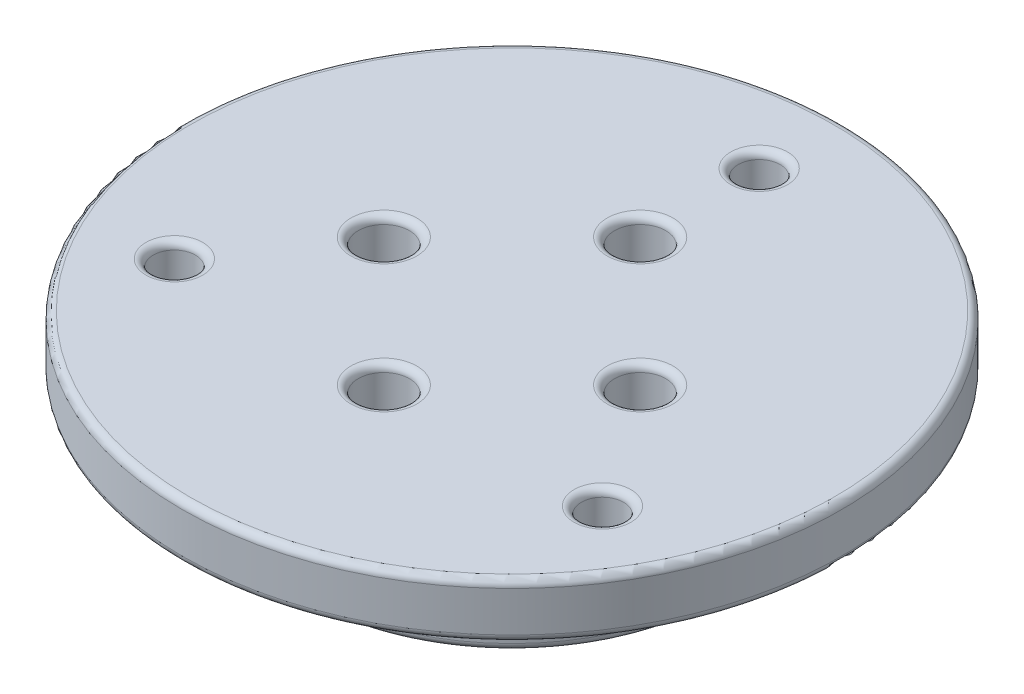
from build123d import *

# Parameters (mm, degrees)
SKETCH2_R          = 1.15
SKETCH2_R_2        = 1.4
CUT_EXTRUDE1_DEPTH = 27.683328128
FILLET2_R          = 0.4


with BuildPart() as part:
    # Sketch1 → Revolve1 (revolve)
    with BuildSketch(Plane.XY, mode=Mode.PRIVATE) as revolve1_sk:
        Polygon((0, 0), (11.5, 0), (11.5, 5), (18, 5), (18, 8), (0, 8), align=None)
    revolve(revolve1_sk.sketch.rotate(Axis((0, 0, 0), (0, 1, 0)), 90), axis=Axis((0, 0, 0), (0, 1, 0)))

    # Sketch2 → Cut-Extrude1 (cut, through all)
    with BuildSketch(Plane(origin=(0, 8, 0), x_dir=(1, 0, 0), z_dir=(0, 1, 0))):
        with Locations(Location((0, 13.5, 0), (0, 0, 270))):
            Circle(SKETCH2_R)
        with Locations(Location((11.691342951, -6.75, 0), (0, 0, 270))):
            Circle(SKETCH2_R)
        with Locations(Location((-11.691342951, -6.75, 0), (0, 0, 270))):
            Circle(SKETCH2_R)
        with Locations(Location((0, 7, 0), (0, 0, 270))):
            Circle(SKETCH2_R_2)
        with Locations(Location((7, 0, 0), (0, 0, 270))):
            Circle(SKETCH2_R_2)
        with Locations(Location((0, -7, 0), (0, 0, 270))):
            Circle(SKETCH2_R_2)
        with Locations(Location((-7, 0, 0), (0, 0, 270))):
            Circle(SKETCH2_R_2)
    extrude(amount=-CUT_EXTRUDE1_DEPTH, mode=Mode.SUBTRACT)

    # Fillet2
    fillet2_edges = [part.edges().sort_by_distance(p)[0] for p in [
        (0, 5, -14.65),
        (0, 8, -14.65),
        (-7, 0, -1.4),
        (-7, 8, -1.4),
        (0, 0, 5.6),
        (0, 8, 5.6),
        (0, 0, -8.4),
        (0, 8, -8.4),
        (11.691342951, 5, 5.6),
        (11.691342951, 8, 5.6),
        (-11.691342951, 5, 5.6),
        (-11.691342951, 8, 5.6),
        (7, 0, -1.4),
        (7, 8, -1.4),
        (0, 8, 18),
        (0, 5, 18),
        (0, 5, 11.5),
        (0, 0, 11.5),
    ]]
    fillet(fillet2_edges, radius=FILLET2_R)


solid = part.part
